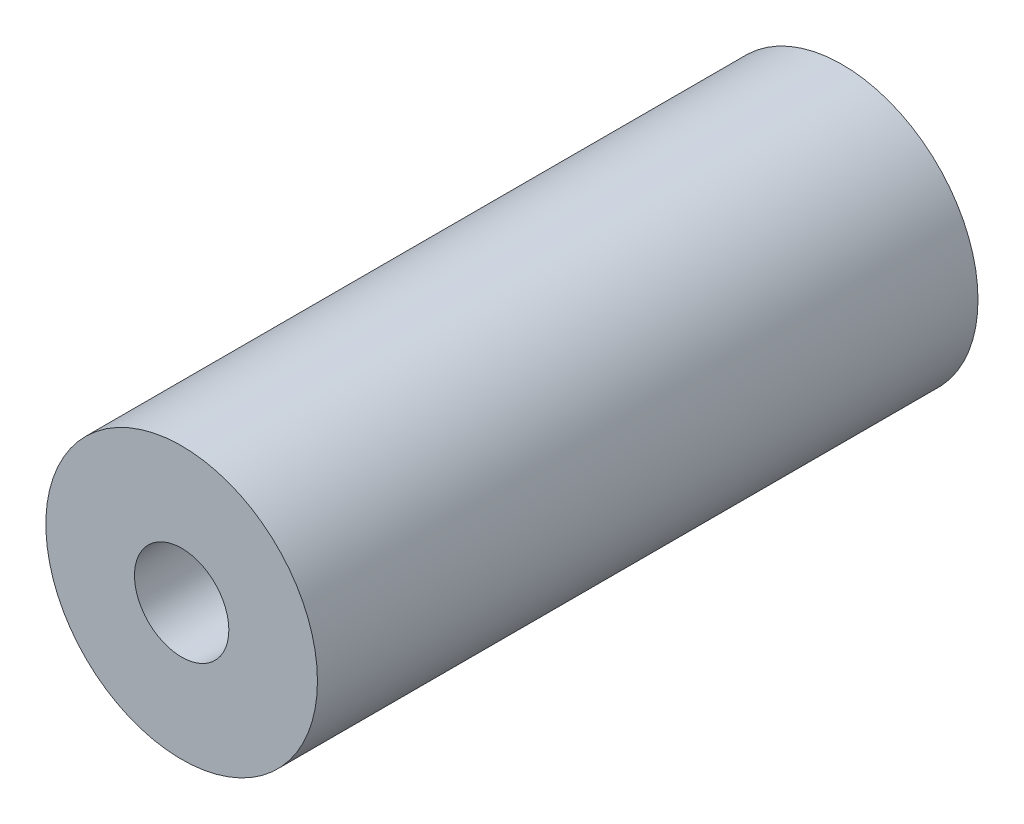
from build123d import *

# Parameters (mm, degrees)
SKETCH3_R      = 8.635
BODY_DEPTH     = 42
CUT_HOLE_REACH = 45.739
SKETCH4_R      = 3


with BuildPart() as part:
    # Sketch3 → body (new body)
    with BuildSketch(Plane.XY):
        Circle(SKETCH3_R)
    extrude(amount=-BODY_DEPTH)

    # Sketch4 → cut-hole (cut, up to next)
    with BuildSketch(Plane.XY, mode=Mode.PRIVATE) as cut_hole_sk1:
        Circle(SKETCH4_R)
    cut_hole_tool1 = extrude(cut_hole_sk1.sketch, amount=-CUT_HOLE_REACH, mode=Mode.PRIVATE) & part.part
    add(cut_hole_tool1.solids().sort_by_distance((0, 0, 0))[0], mode=Mode.SUBTRACT)


solid = part.part
